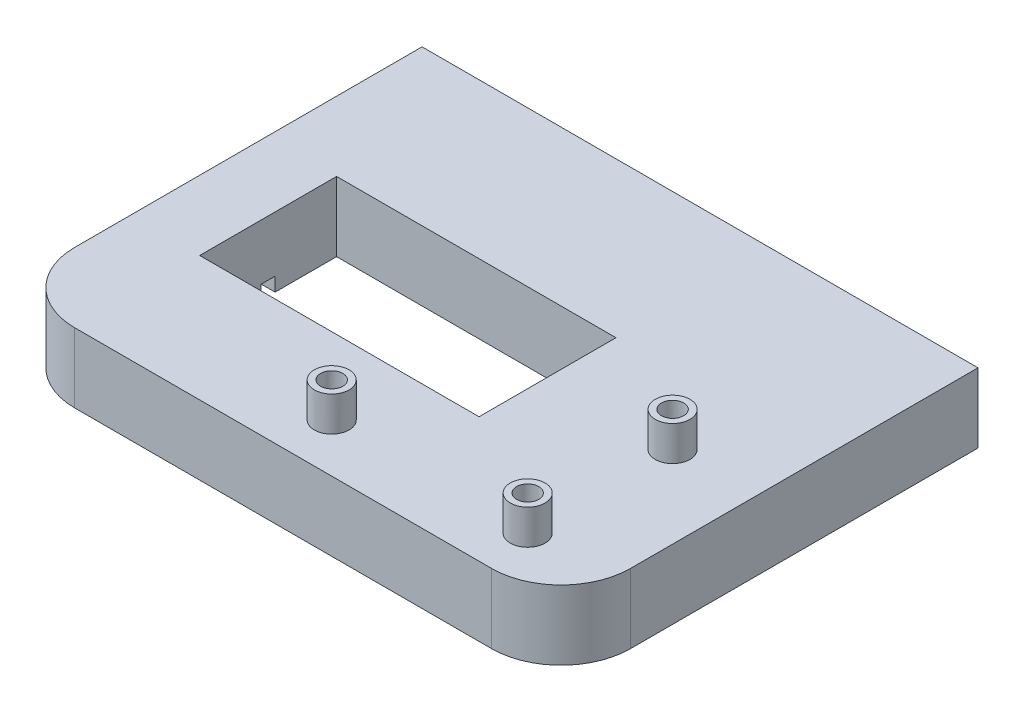
from build123d import *

# Parameters (mm, degrees)
SKETCH2_W           = 80
SKETCH2_H           = 60
BOSS_EXTRUDE1_DEPTH = 10
SKETCH3_W           = 40.2
SKETCH3_H           = 19.7
CUT_EXTRUDE1_DEPTH  = 10
FILLET1_R           = 10
SKETCH4_R           = 2.5
SKETCH4_R_2         = 1.6
BOSS_EXTRUDE2_DEPTH = 5
CUT_EXTRUDE2_START  = -21
SKETCH5_R           = 1.6
CUT_EXTRUDE2_DEPTH  = 21
SKETCH7_W           = 55
SKETCH7_H           = 2
CUT_EXTRUDE3_DEPTH  = 2
CUT_EXTRUDE4_DEPTH  = 3


with BuildPart() as part:
    # Sketch2 → Boss-Extrude1 (new body)
    with BuildSketch(Plane(origin=(0, 0, 0), x_dir=(1, 0, 0), z_dir=(0, 1, 0))):
        Rectangle(SKETCH2_W, SKETCH2_H)
    extrude(amount=BOSS_EXTRUDE1_DEPTH)

    # Sketch3 → Cut-Extrude1 (cut)
    with BuildSketch(Plane(origin=(0, 10, 0), x_dir=(1, 0, 0), z_dir=(0, 1, 0))):
        with Locations((-9.9, -2.15)):
            Rectangle(SKETCH3_W, SKETCH3_H)
    extrude(amount=-CUT_EXTRUDE1_DEPTH, mode=Mode.SUBTRACT)

    # Fillet1
    fillet1_edges = [part.edges().sort_by_distance(p)[0] for p in [
        (40, 5, 30),
        (-40, 5, 30),
    ]]
    fillet(fillet1_edges, radius=FILLET1_R)

    # Sketch4 → Boss-Extrude2 (add)
    # profile 1 of 3: a face of its own
    with BuildSketch(Plane(origin=(0, 10, 0), x_dir=(1, 0, 0), z_dir=(0, 1, 0))):
        with Locations(Location((28.2, -2.15, 0), (0, 0, 90))):
            Circle(SKETCH4_R)
        with Locations(Location((28.2, -2.15, 0), (0, 0, 270))):
            Circle(SKETCH4_R_2, mode=Mode.SUBTRACT)
    # profile 2 of 3: a face of its own
    with BuildSketch(Plane(origin=(0, 10, 0), x_dir=(1, 0, 0), z_dir=(0, 1, 0))):
        with Locations(Location((0, -23, 0), (0, 0, 90))):
            Circle(SKETCH4_R)
        with Locations(Location((0, -23, 0), (0, 0, 270))):
            Circle(SKETCH4_R_2, mode=Mode.SUBTRACT)
    # profile 3 of 3: a face of its own
    with BuildSketch(Plane(origin=(0, 10, 0), x_dir=(1, 0, 0), z_dir=(0, 1, 0))):
        with Locations(Location((28.2, -23, 0), (0, 0, 90))):
            Circle(SKETCH4_R)
        with Locations(Location((28.2, -23, 0), (0, 0, 270))):
            Circle(SKETCH4_R_2, mode=Mode.SUBTRACT)
    extrude(amount=BOSS_EXTRUDE2_DEPTH)

    # Sketch5 → Cut-Extrude2 (cut)
    with BuildSketch(Plane(origin=(0, 10, 0), x_dir=(1, 0, 0), z_dir=(0, 1, 0)).offset(CUT_EXTRUDE2_START)):
        with Locations(Location((0, -23, 0), (0, 0, 90))):
            Circle(SKETCH5_R)
        with Locations(Location((28.2, -23, 0), (0, 0, 90))):
            Circle(SKETCH5_R)
        with Locations(Location((28.2, -2.15, 0), (0, 0, 90))):
            Circle(SKETCH5_R)
    extrude(amount=CUT_EXTRUDE2_DEPTH, mode=Mode.SUBTRACT)

    # Sketch7 → Cut-Extrude3 (cut)
    with BuildSketch(Plane.XZ):
        with Locations((-9.9, 2.15)):
            Rectangle(SKETCH7_W, SKETCH7_H)
    extrude(amount=-CUT_EXTRUDE3_DEPTH, mode=Mode.SUBTRACT)

    # Sketch8 → Cut-Extrude4 (cut)
    with BuildSketch(Plane.XZ):
        Polygon((3.464101615, 23), (1.732050808, 26), (-1.732050808, 26), (-3.464101615, 23), (-1.732050808, 20), (1.732050808, 20), align=None)
        Polygon((31.664101615, 23), (29.932050808, 26), (26.467949192, 26), (24.735898385, 23), (26.467949192, 20), (29.932050808, 20), align=None)
        Polygon((31.664101615, 2.15), (29.932050808, 5.15), (26.467949192, 5.15), (24.735898385, 2.15), (26.467949192, -0.85), (29.932050808, -0.85), align=None)
    extrude(amount=-CUT_EXTRUDE4_DEPTH, mode=Mode.SUBTRACT)


solid = part.part
